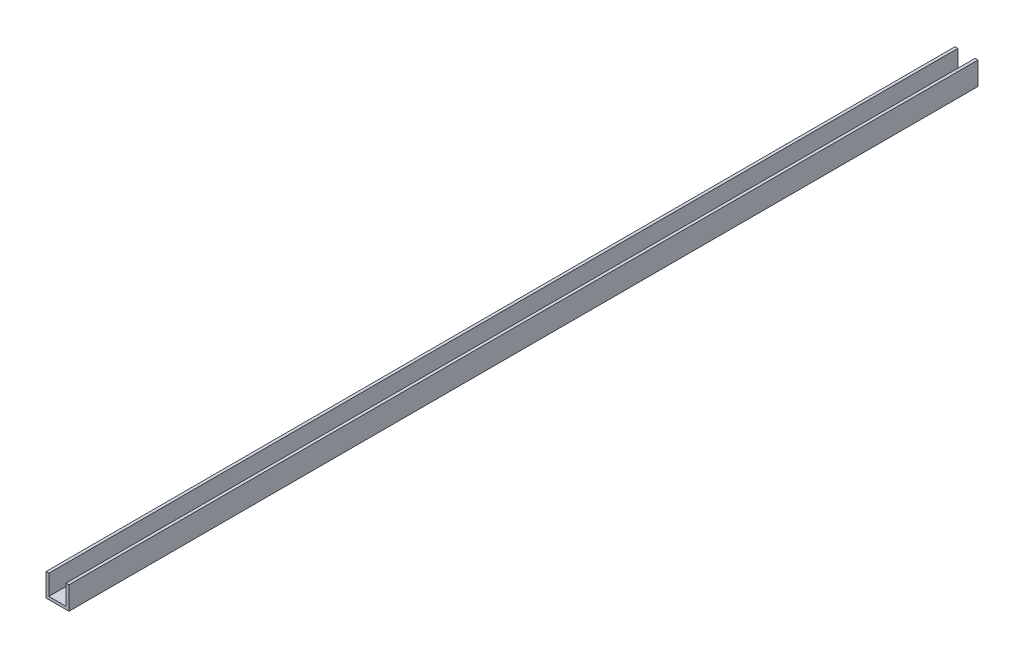
from build123d import *

# Parameters (mm, degrees)
BOSS_EXTRUDE1_DEPTH = 475
SKETCH2_R           = 2.5
CUT_EXTRUDE1_DEPTH  = 10


with BuildPart() as part:
    # Sketch1 → Boss-Extrude1 (new body)
    with BuildSketch(Plane.XY):
        Polygon((-10.5, 12), (-12, 12), (-12, 0), (0, 0), (0, 12), (-1.5, 12), (-1.5, 1.5), (-10.5, 1.5), align=None)
    extrude(amount=BOSS_EXTRUDE1_DEPTH)

    # Sketch2 → Cut-Extrude1 (cut)
    with BuildSketch(Plane(origin=(0, 1.5, 0), x_dir=(1, 0, 0), z_dir=(0, 1, 0))):
        with Locations(Location((-6, -6, 0), (0, 0, 270))):
            Circle(SKETCH2_R)
    extrude(amount=-CUT_EXTRUDE1_DEPTH, mode=Mode.SUBTRACT)


solid = part.part
